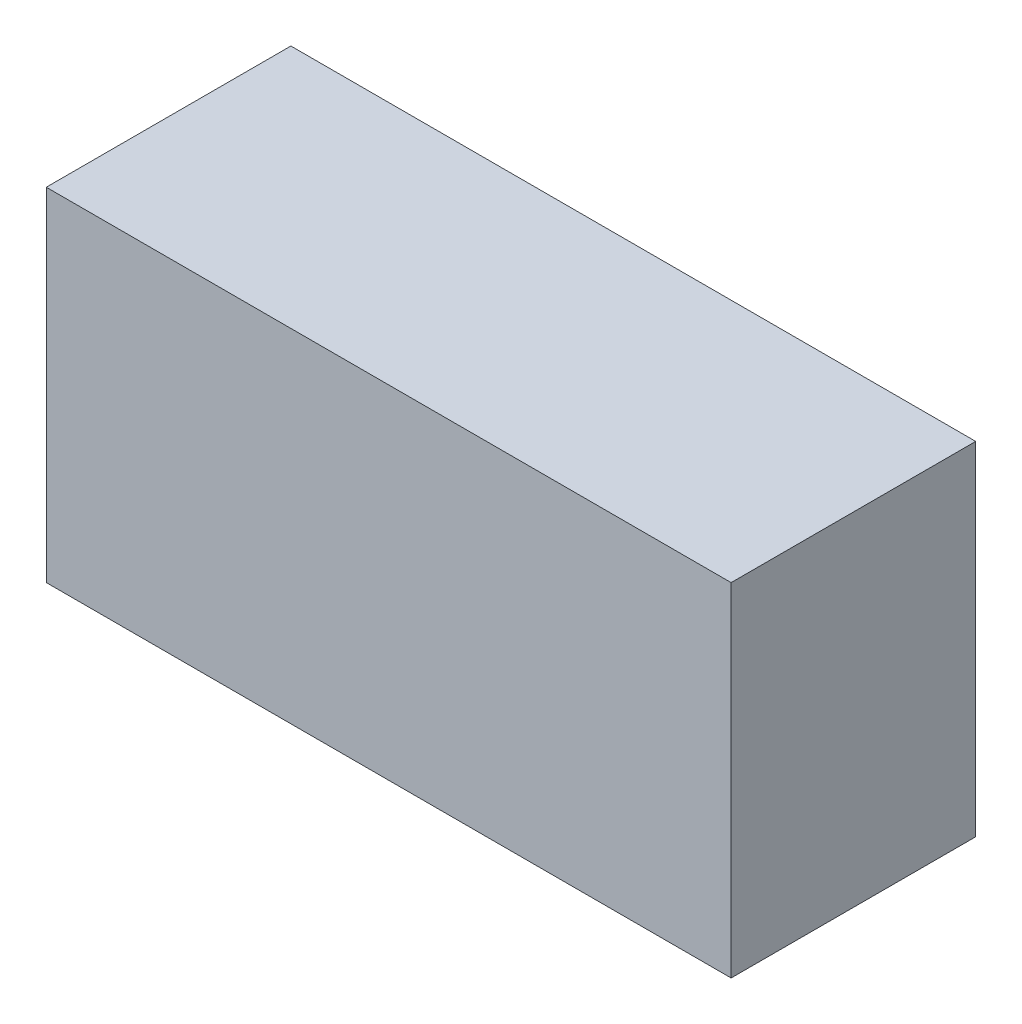
from build123d import *

# Parameters (mm, degrees)
SKETCH_1_W      = 70
SKETCH_1_H      = 35
EXTRUDE_1_DEPTH = 25


with BuildPart() as part:
    # 스케치1 → 보스-돌출1 (new body)
    with BuildSketch(Plane.XY):
        with Locations((5.164463654, 10.9375)):
            Rectangle(SKETCH_1_W, SKETCH_1_H)
    extrude(amount=EXTRUDE_1_DEPTH)


solid = part.part
